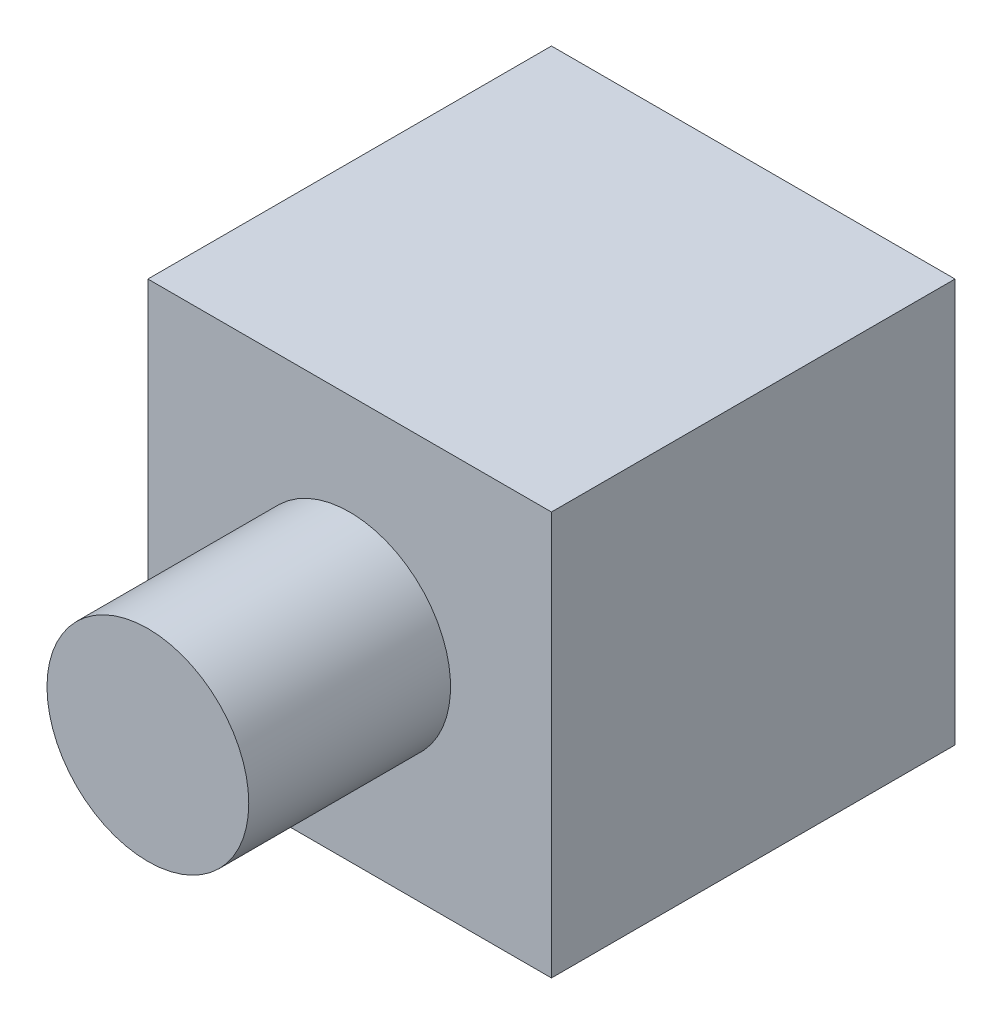
from build123d import *

# Parameters (mm, degrees)
SKETCH1_W           = 50.8
SKETCH1_H           = 50.8
BOSS_EXTRUDE1_DEPTH = 50.8
SKETCH2_R           = 12.7
BOSS_EXTRUDE2_DEPTH = 25.4
SKETCH3_R           = 12.7
CUT_EXTRUDE1_DEPTH  = 25.4


with BuildPart() as part:
    # Sketch1 → Boss-Extrude1 (new body)
    with BuildSketch(Plane.XY):
        Rectangle(SKETCH1_W, SKETCH1_H)
    extrude(amount=BOSS_EXTRUDE1_DEPTH)

    # Sketch2 → Boss-Extrude2 (add)
    with BuildSketch(Plane.XY.offset(50.8)):
        with Locations(Location((0, 0, 0), (0, 0, 180))):
            Circle(SKETCH2_R)
    extrude(amount=BOSS_EXTRUDE2_DEPTH)

    # Sketch3 → Cut-Extrude1 (cut)
    with BuildSketch(Plane(origin=(0, 0, 0), x_dir=(-1, 0, 0), z_dir=(0, 0, -1))):
        Circle(SKETCH3_R)
    extrude(amount=-CUT_EXTRUDE1_DEPTH, mode=Mode.SUBTRACT)


solid = part.part
